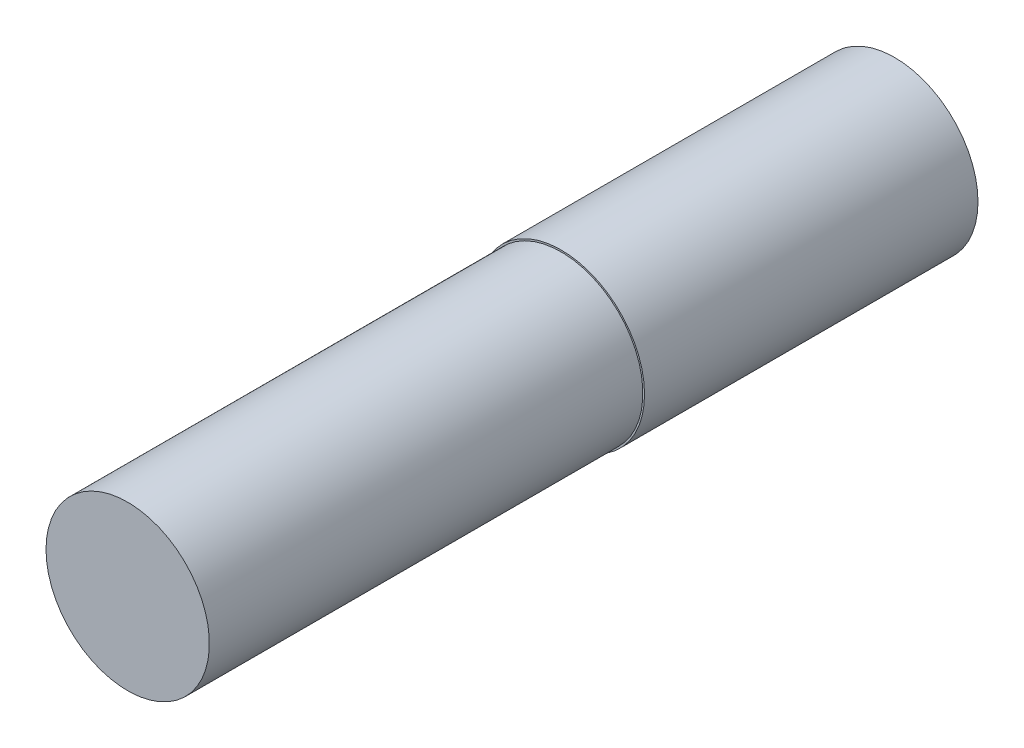
from build123d import *

# Parameters (mm, degrees)
ESQUISSE1_R        = 2.5
BOSS_EXTRU_1_DEPTH = 10
ESQUISSE2_R        = 2.45
BOSS_EXTRU_2_DEPTH = 13


with BuildPart() as part:
    # Esquisse1 → Boss.-Extru.1 (new body)
    with BuildSketch(Plane.XY):
        Circle(ESQUISSE1_R)
    extrude(amount=BOSS_EXTRU_1_DEPTH)

    # Esquisse2 → Boss.-Extru.2 (add)
    with BuildSketch(Plane.XY.offset(10)):
        with Locations(Location((0, 0, 0), (0, 0, 180))):
            Circle(ESQUISSE2_R)
    extrude(amount=BOSS_EXTRU_2_DEPTH)


solid = part.part
